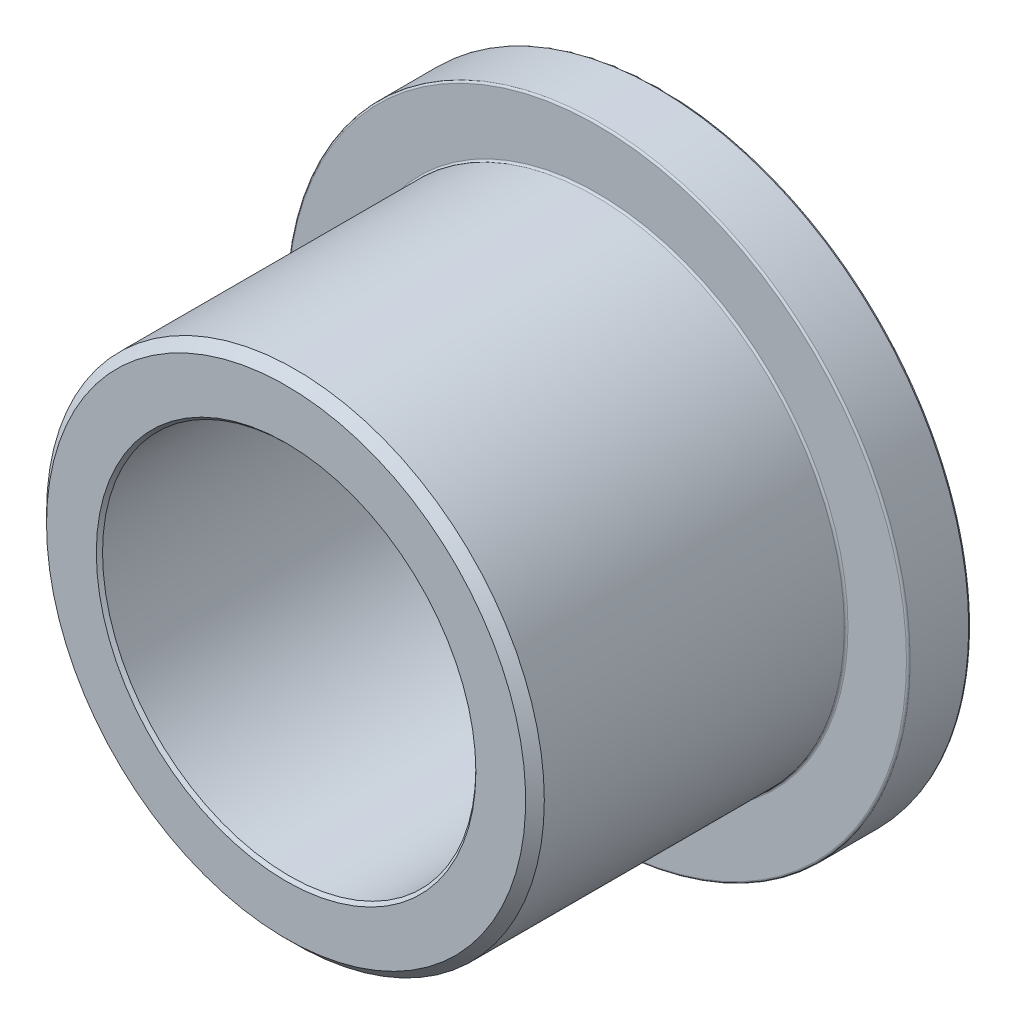
from build123d import *

# Parameters (mm, degrees)
CHAMFER1_SIZE = 0.238125
CHAMFER2_SIZE = 0.079375
FILLET1_R     = 0.047625


with BuildPart() as part:
    # Sketch3 → Revolve1 (revolve)
    with BuildSketch(Plane(origin=(0, 0, 0), x_dir=(0, 0, -1), z_dir=(1, 0, 0)), mode=Mode.PRIVATE) as revolve1_sk:
        Polygon((4.7625, -7.9375), (3.175, -7.9375), (3.175, -6.35), (-4.7625, -6.35), (-4.7625, -4.7625), (4.7625, -4.7625), align=None)
    revolve(revolve1_sk.sketch.rotate(Axis((0, 0, 4.7625), (0, 0, -1)), 270), axis=Axis((0, 0, 4.7625), (0, 0, -1)))

    # Chamfer1
    chamfer1_edges = [part.edges().sort_by_distance(p)[0] for p in [
        (-6.35, 0, 4.7625),
    ]]
    chamfer(chamfer1_edges, length=CHAMFER1_SIZE)

    # Chamfer2
    chamfer2_edges = [part.edges().sort_by_distance(p)[0] for p in [
        (-4.7625, 0, -4.7625),
        (-4.7625, 0, 4.7625),
    ]]
    chamfer(chamfer2_edges, length=CHAMFER2_SIZE)

    # Fillet1
    fillet1_edges = [part.edges().sort_by_distance(p)[0] for p in [
        (-6.35, 0, -3.175),
        (-7.9375, 0, -3.175),
        (-7.9375, 0, -4.7625),
    ]]
    fillet(fillet1_edges, radius=FILLET1_R)


solid = part.part
